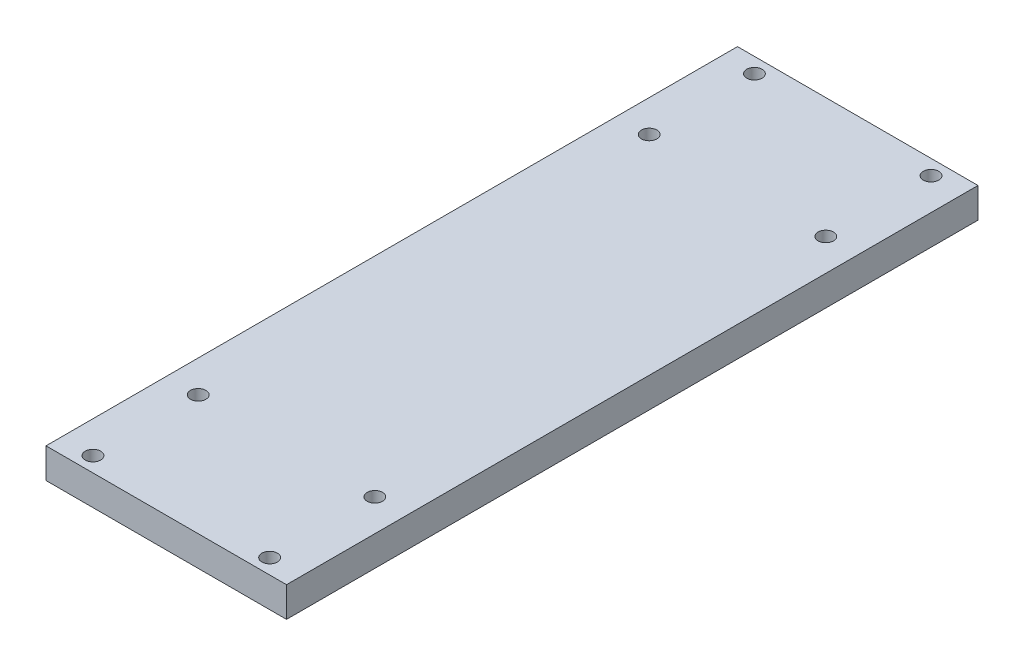
from build123d import *

# Parameters (mm, degrees)
SKETCH1_W                = 101.6
SKETCH1_H                = 292.1
EXTRUDE1_DEPTH           = 12.7
F_5_16_18_TAPPED_HOLE1_D = 6.5278


with BuildPart() as part:
    # Sketch1 → Extrude1 (new body)
    with BuildSketch(Plane(origin=(0, 0, 0), x_dir=(1, 0, 0), z_dir=(0, 1, 0))):
        with Locations((50.8, 146.05)):
            Rectangle(SKETCH1_W, SKETCH1_H)
    extrude(amount=EXTRUDE1_DEPTH)

    # 5/16-18 Tapped Hole1 (through all)
    with Locations(Plane(origin=(0, 12.7, 0), x_dir=(-1, 0, 0), z_dir=(0, 1, 0))):
        with Locations((-88.10625, -6.35), (-13.49375, -241.3), (-88.10625, -241.3), (-88.10625, -285.75), (-13.49375, -285.75), (-88.10625, -50.8), (-13.49375, -50.8), (-13.49375, -6.35)):
            Hole(F_5_16_18_TAPPED_HOLE1_D / 2)


solid = part.part
